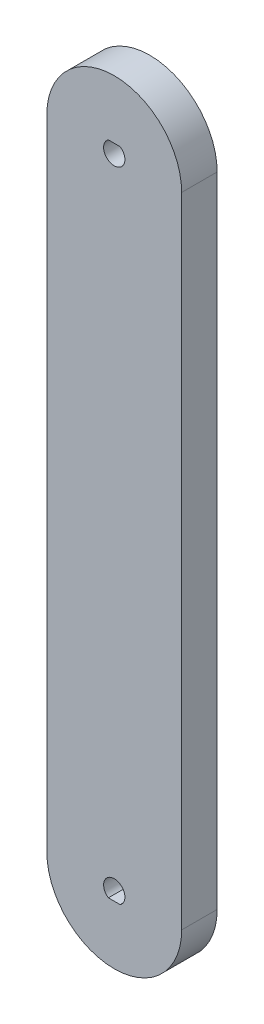
from build123d import *

# Parameters (mm, degrees)
EXTRUDE_1_DEPTH = 10


with BuildPart() as part:
    # 草图1 → 凸台-拉伸1 (new body)
    with BuildSketch(Plane.XY):
        with BuildLine():
            Line((19, -90), (19, 90))
            ThreePointArc((19, 90), (0, 109), (-19, 90))
            Line((-19, 90), (-19, -90))
            ThreePointArc((-19, -90), (0, -109), (19, -90))
        make_face()
        with BuildLine():
            ThreePointArc((-1.658312395, -92.5), (0, -87), (1.658312395, -92.5))
            Line((1.658312395, -92.5), (-1.658312395, -92.5))
        make_face(mode=Mode.SUBTRACT)
        with BuildLine():
            Line((-1.658312395, 92.5), (1.658312395, 92.5))
            ThreePointArc((1.658312395, 92.5), (0, 87), (-1.658312395, 92.5))
        make_face(mode=Mode.SUBTRACT)
    extrude(amount=EXTRUDE_1_DEPTH)


solid = part.part
